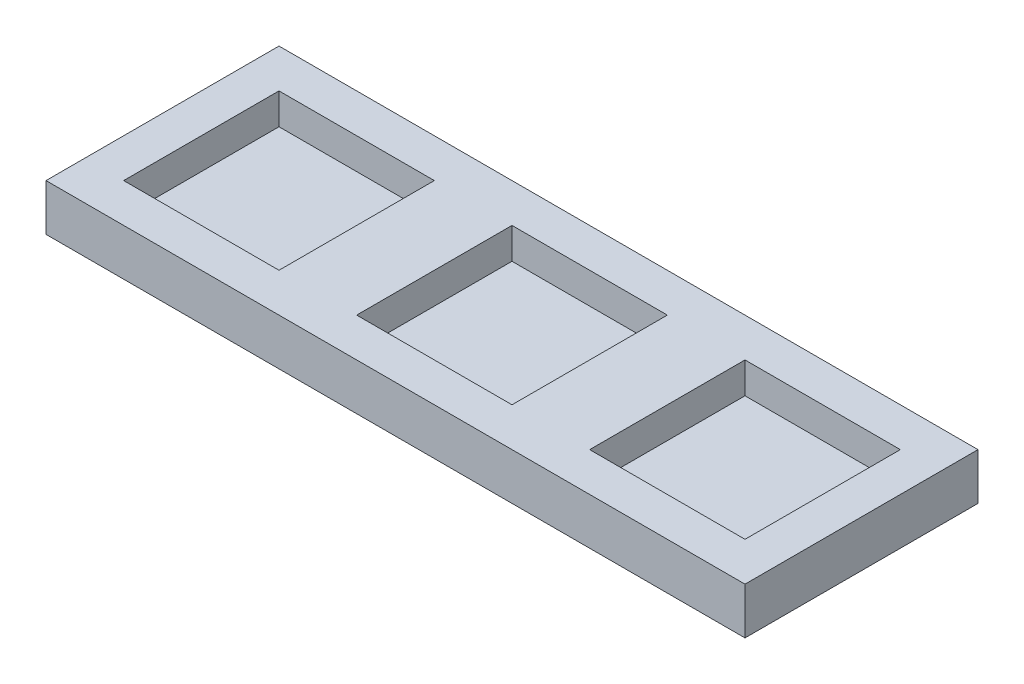
from build123d import *

# Parameters (mm, degrees)
SKETCH_1_W          = 450
SKETCH_1_H          = 150
EXTRUDE_1_DEPTH     = 30
SKETCH_2_W          = 100
SKETCH_2_H          = 100
CUT_EXTRUDE_1_DEPTH = 20


with BuildPart() as part:
    # 草图1 → 凸台-拉伸1 (new body)
    with BuildSketch(Plane(origin=(0, 0, 0), x_dir=(1, 0, 0), z_dir=(0, 1, 0))):
        with Locations((0, -75)):
            Rectangle(SKETCH_1_W, SKETCH_1_H)
    extrude(amount=EXTRUDE_1_DEPTH)

    # 草图2 → 切除-拉伸1 (cut)
    with BuildSketch(Plane(origin=(0, 30, 0), x_dir=(1, 0, 0), z_dir=(0, 1, 0))):
        with Locations((0, -75)):
            Rectangle(SKETCH_2_W, SKETCH_2_H)
        with Locations((-150, -75)):
            Rectangle(SKETCH_2_W, SKETCH_2_H)
        with Locations((150, -75)):
            Rectangle(SKETCH_2_W, SKETCH_2_H)
        with Locations((300, -75)):
            Rectangle(SKETCH_2_W, SKETCH_2_H)
        with Locations((450, -75)):
            Rectangle(SKETCH_2_W, SKETCH_2_H)
    extrude(amount=-CUT_EXTRUDE_1_DEPTH, mode=Mode.SUBTRACT)


solid = part.part
